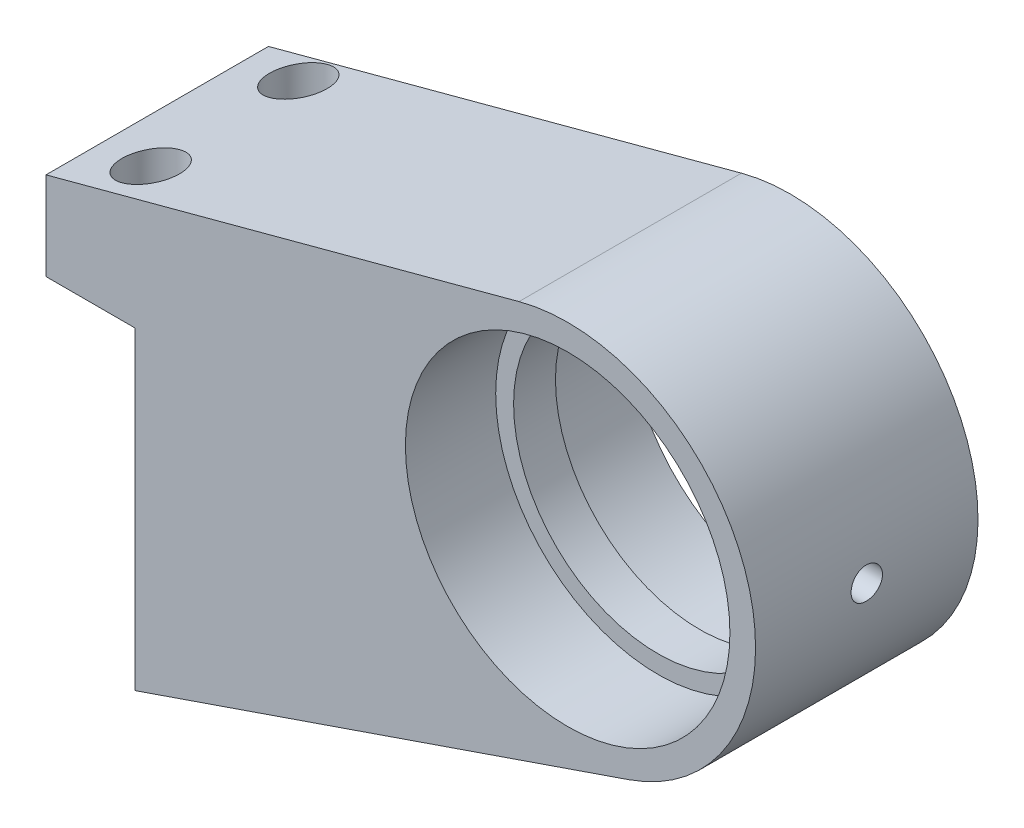
from build123d import *

# Parameters (mm, degrees)
SKETCH1_R                                    = 31
BOSS_EXTRUDE1_DEPTH                          = 21.25
CUT_EXTRUDE1_DEPTH                           = 91
F_5_0MM_DOWEL_HOLE1_D                        = 5
F_5_0MM_DOWEL_HOLE1_DEPTH                    = 8
F_5_0MM_DOWEL_HOLE1_TIP                      = 1.502151548
CBORE_FOR_M8_HEX_HEAD_CAP_SCREW2_D           = 6.5
CBORE_FOR_M8_HEX_HEAD_CAP_SCREW2_CBORE_D     = 11
CBORE_FOR_M8_HEX_HEAD_CAP_SCREW2_CBORE_DEPTH = 13
SKETCH18_R                                   = 31
SKETCH18_R_2                                 = 27.58
BOSS_EXTRUDE2_DEPTH                          = 4
SKETCH21_R                                   = 3
CUT_EXTRUDE2_DEPTH                           = 122.617548954


with BuildPart() as part:
    # Sketch1 → Boss-Extrude1 (new, symmetric)
    with BuildSketch(Plane.XY):
        with BuildLine():
            Line((-99.665912553, 10.461014095), (-99.665912553, -6.377493087))
            Line((-99.665912553, -6.377493087), (-82.665912553, -6.377493087))
            Line((-82.665912553, -6.377493087), (-82.665912553, -66.377493087))
            Line((-82.665912553, -66.377493087), (11.670122046, -33.950231979))
            ThreePointArc((11.670122046, -33.950231979), (34.334087447, 10.487155916), (-9.291603719, 34.676737164))
            Line((-9.291603719, 34.676737164), (-99.665912553, 10.461014095))
        make_face()
        Circle(SKETCH1_R, mode=Mode.SUBTRACT)
    extrude(amount=BOSS_EXTRUDE1_DEPTH, both=True)

    # Sketch5 → Cut-Extrude1 (cut)
    with BuildSketch(Plane.ZY.offset(82.665912553)):
        Polygon((-21.25, -66.377493087), (8.75, -66.377493087), (-21.25, -36.377493087), align=None)
    extrude(amount=-CUT_EXTRUDE1_DEPTH, mode=Mode.SUBTRACT)

    # Ø5.0mm Dowel Hole1
    with Locations(Plane.ZY.offset(82.665912553)):
        with Locations((15.68, -60.677493087), (15.68, -36.677493087), (-98.628383383, 36.760601071), (0.68, -44.677493087), (35.6, -82.217865389)):
            Hole(F_5_0MM_DOWEL_HOLE1_D / 2, depth=F_5_0MM_DOWEL_HOLE1_DEPTH)
            with Locations((0, 0, -(F_5_0MM_DOWEL_HOLE1_DEPTH + F_5_0MM_DOWEL_HOLE1_TIP / 2))):  # 118° drill point
                Cone(0, F_5_0MM_DOWEL_HOLE1_D / 2, F_5_0MM_DOWEL_HOLE1_TIP, mode=Mode.SUBTRACT)

    # CBORE for M8 Hex Head Cap Screw2 (through all)
    with Locations(Plane(origin=(0, 17.622506913, 0), x_dir=(-1, 0, 0), z_dir=(0, 1, 0))):
        with Locations((87.965912553, -15.25), (87.965912553, 12.95)):
            CounterBoreHole(CBORE_FOR_M8_HEX_HEAD_CAP_SCREW2_D / 2, CBORE_FOR_M8_HEX_HEAD_CAP_SCREW2_CBORE_D / 2, CBORE_FOR_M8_HEX_HEAD_CAP_SCREW2_CBORE_DEPTH)

    # Sketch18 → Boss-Extrude2 (add, symmetric)
    with BuildSketch(Plane(origin=(0, 0, 0), x_dir=(-1, 0, 0), z_dir=(0, 0, -1))):
        Circle(SKETCH18_R)
        Circle(SKETCH18_R_2, mode=Mode.SUBTRACT)
    extrude(amount=BOSS_EXTRUDE2_DEPTH, both=True)

    # Sketch21 → Cut-Extrude2 (cut, through all)
    with BuildSketch(Plane(origin=(0, 0, 0), x_dir=(0, 0, -1), z_dir=(1, 0, 0))):
        with Locations(Location((0, 0, 0), (0, 0, 180))):
            Circle(SKETCH21_R)
    extrude(amount=CUT_EXTRUDE2_DEPTH, mode=Mode.SUBTRACT)


solid = part.part
